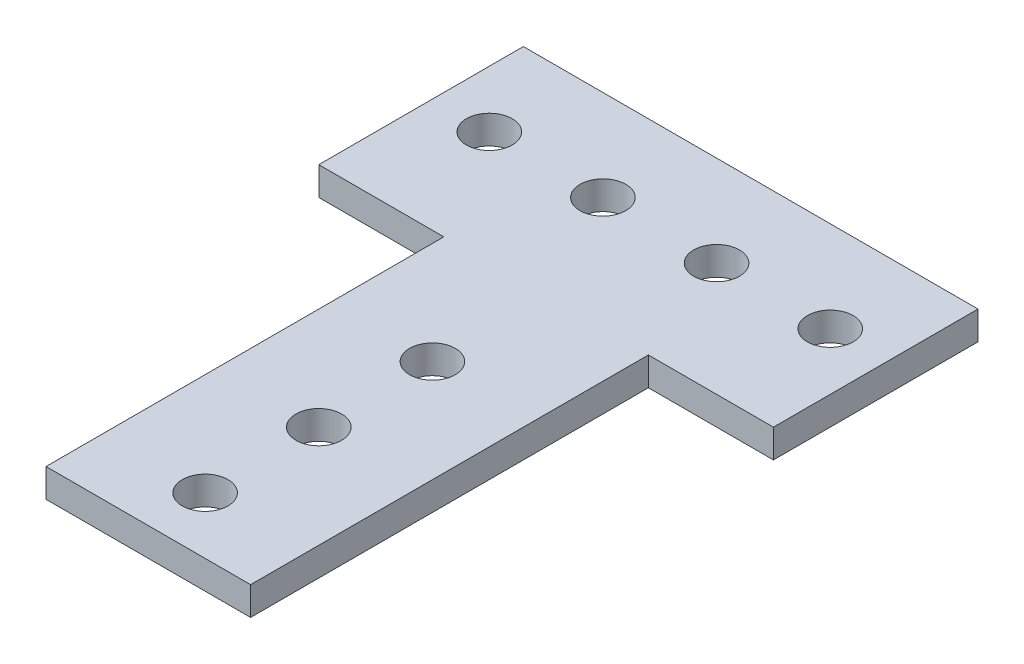
from build123d import *

# Parameters (mm, degrees)
BOSS_EXTRUDE1_DEPTH = 3.175
SKETCH2_R           = 2.5527
CUT_EXTRUDE1_DEPTH  = 77.793005053
SKETCH3_R           = 2.5527
CUT_EXTRUDE2_DEPTH  = 77.793005053


with BuildPart() as part:
    # Sketch1 → Boss-Extrude1 (new body)
    with BuildSketch(Plane(origin=(0, 0, 0), x_dir=(1, 0, 0), z_dir=(0, 1, 0))):
        Polygon((0, 0), (0, 44.45), (-13.97, 44.45), (-13.97, 67.31), (36.83, 67.31), (36.83, 44.45), (22.86, 44.45), (22.86, 0), align=None)
    extrude(amount=BOSS_EXTRUDE1_DEPTH)

    # Sketch2 → Cut-Extrude1 (cut, through all)
    with BuildSketch(Plane(origin=(0, 3.175, 0), x_dir=(1, 0, 0), z_dir=(0, 1, 0))):
        with Locations(Location((-7.62, 57.15, 0), (0, 0, 270))):
            Circle(SKETCH2_R)
        with Locations(Location((5.08, 57.15, 0), (0, 0, 270))):
            Circle(SKETCH2_R)
        with Locations(Location((17.78, 57.15, 0), (0, 0, 270))):
            Circle(SKETCH2_R)
        with Locations(Location((30.48, 57.15, 0), (0, 0, 270))):
            Circle(SKETCH2_R)
    extrude(amount=-CUT_EXTRUDE1_DEPTH, mode=Mode.SUBTRACT)

    # Sketch3 → Cut-Extrude2 (cut, through all)
    with BuildSketch(Plane(origin=(0, 3.175, 0), x_dir=(1, 0, 0), z_dir=(0, 1, 0))):
        with Locations(Location((11.43, 31.75, 0), (0, 0, 270))):
            Circle(SKETCH3_R)
        with Locations(Location((11.43, 19.05, 0), (0, 0, 270))):
            Circle(SKETCH3_R)
        with Locations(Location((11.43, 6.35, 0), (0, 0, 270))):
            Circle(SKETCH3_R)
    extrude(amount=-CUT_EXTRUDE2_DEPTH, mode=Mode.SUBTRACT)


solid = part.part
